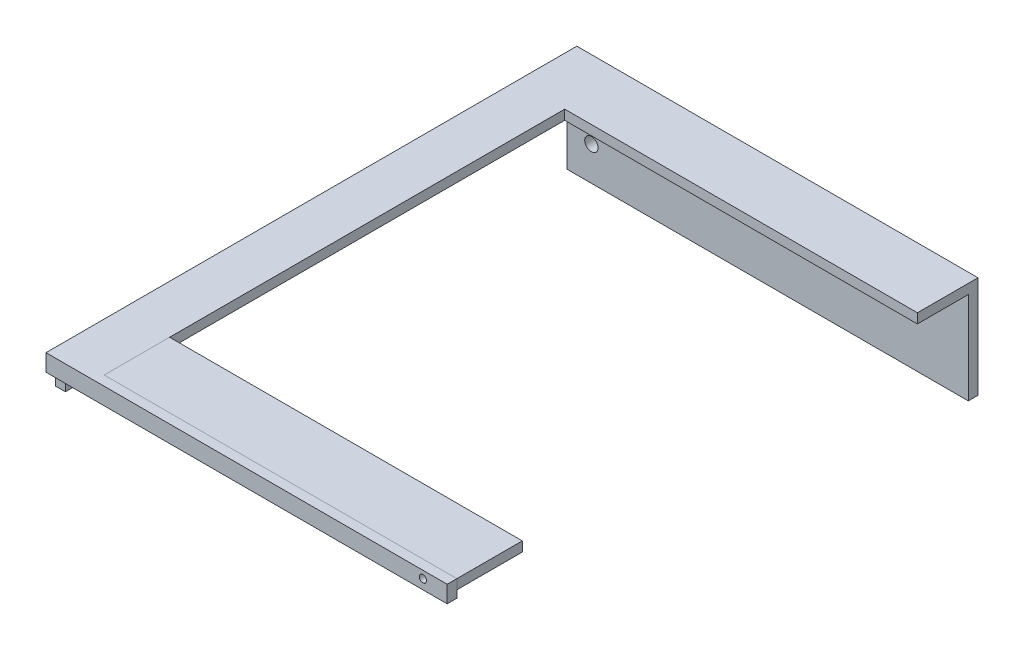
from build123d import *

# Parameters (mm, degrees)
SKETCH_1_W          = 165.5
SKETCH_1_H          = 38
EXTRUDE_1_DEPTH     = 4
SKETCH_2_W          = 20
SKETCH_2_H          = 215
EXTRUDE_2_DEPTH     = 4
SKETCH_3_W          = 211
SKETCH_3_H          = 10
EXTRUDE_3_DEPTH     = 4
SKETCH_4_W          = 145.5
SKETCH_4_H          = 25
EXTRUDE_4_DEPTH     = 4
SKETCH_5_R          = 1.5
CUT_EXTRUDE_1_DEPTH = 4
SKETCH_6_W          = 165.5
SKETCH_6_H          = 7
EXTRUDE_5_DEPTH     = 4
SKETCH_7_W          = 145.5
SKETCH_7_H          = 27
EXTRUDE_6_DEPTH     = 4
SKETCH_8_R          = 2.75
CUT_EXTRUDE_2_DEPTH = 4
SKETCH_9_R          = 1.5
CUT_EXTRUDE_3_DEPTH = 20


with BuildPart() as part:
    # 草图1 → 凸台-拉伸1 (new body)
    with BuildSketch(Plane.XY):
        with Locations((82.75, -19)):
            Rectangle(SKETCH_1_W, SKETCH_1_H)
    extrude(amount=EXTRUDE_1_DEPTH)

    # 草图2 → 凸台-拉伸2 (add)
    with BuildSketch(Plane(origin=(0, 0, 0), x_dir=(1, 0, 0), z_dir=(0, 1, 0))):
        with Locations((10, -107.5)):
            Rectangle(SKETCH_2_W, SKETCH_2_H)
    extrude(amount=EXTRUDE_2_DEPTH)

    # 草图3 → 凸台-拉伸3 (add)
    with BuildSketch(Plane.ZY):
        with Locations((109.5, -5)):
            Rectangle(SKETCH_3_W, SKETCH_3_H)
    extrude(amount=-EXTRUDE_3_DEPTH)

    # 草图4 → 凸台-拉伸4 (add)
    with BuildSketch(Plane(origin=(0, 0, 0), x_dir=(1, 0, 0), z_dir=(0, 1, 0))):
        with Locations((92.75, -12.5)):
            Rectangle(SKETCH_4_W, SKETCH_4_H)
    extrude(amount=EXTRUDE_4_DEPTH)

    # 草图5 → 切除-拉伸1 (cut)
    with BuildSketch(Plane(origin=(0, 0, 0), x_dir=(-1, 0, 0), z_dir=(0, 0, -1))):
        with Locations((-140.5, -16)):
            Circle(SKETCH_5_R)
    extrude(amount=-CUT_EXTRUDE_1_DEPTH, mode=Mode.SUBTRACT)

    # 草图6 → 凸台-拉伸5 (add)
    with BuildSketch(Plane.XY.offset(215)):
        with Locations((82.75, 0.5)):
            Rectangle(SKETCH_6_W, SKETCH_6_H)
    extrude(amount=EXTRUDE_5_DEPTH)

    # 草图8 → 切除-拉伸2 (cut)
    with BuildSketch(Plane(origin=(0, 0, 0), x_dir=(-1, 0, 0), z_dir=(0, 0, -1))):
        with Locations((-10, -24)):
            Circle(SKETCH_8_R)
    extrude(amount=-CUT_EXTRUDE_2_DEPTH, mode=Mode.SUBTRACT)


with BuildPart() as body_2:
    # 草图7 → 凸台-拉伸6 (new body)
    with BuildSketch(Plane(origin=(0, 4, 0), x_dir=(1, 0, 0), z_dir=(0, 1, 0))):
        with Locations((92.75, -201.5)):
            Rectangle(SKETCH_7_W, SKETCH_7_H)
    extrude(amount=-EXTRUDE_6_DEPTH)


with BuildPart() as cut_extrude_3_tool:
    # 草图9 → 切除-拉伸3 (new body)
    with BuildSketch(Plane.XY.offset(219)):
        with Locations((155.5, 1)):
            Circle(SKETCH_9_R)
    extrude(amount=-CUT_EXTRUDE_3_DEPTH)


with BuildPart() as part_1:
    add(part.part)

    # 切除-拉伸3: cut by cut_extrude_3_tool
    add(cut_extrude_3_tool.part, mode=Mode.SUBTRACT)


with BuildPart() as body_2_1:
    add(body_2.part)

    # 切除-拉伸3: cut by cut_extrude_3_tool
    add(cut_extrude_3_tool.part, mode=Mode.SUBTRACT)


solid = Compound([part_1.part, body_2_1.part])
